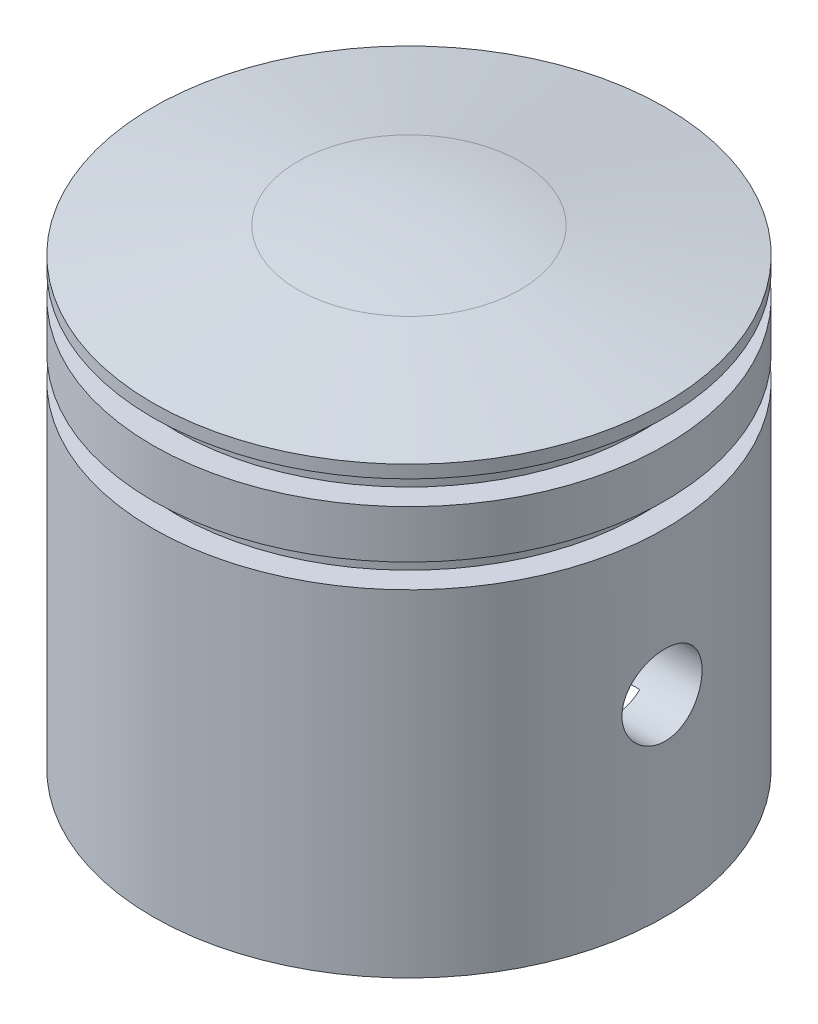
from build123d import *

# Parameters (mm, degrees)
SKETCH2_W               = 5.168520993
SKETCH2_H               = 1.5
SKETCH3_R               = 10
CUT_EXTRUDE1_DEPTH      = 24
SKETCH6_R               = 13
CUT_EXTRUDE2_DEPTH      = 10
CUT_EXTRUDE3_DEPTH      = 38.576588456
CUT_EXTRUDE3_DEPTH_BACK = 38.576588456
SKETCH7_R               = 2.5


with BuildPart() as part:
    # Sketch1 → Revolve2 (revolve)
    with BuildSketch(Plane.XY, mode=Mode.PRIVATE) as revolve2_sk:
        with BuildLine():
            Line((0, 0), (16, 0))
            Line((16, 0), (16, 27.795832784))
            Line((16, 27.795832784), (6.945927107, 29.39231012))
            ThreePointArc((6.945927107, 29.39231012), (3.48622971, 29.847787924), (0, 30))
            Line((0, 30), (0, 0))
        make_face()
    revolve(revolve2_sk.sketch.rotate(Axis((0, 30, 0), (0, -1, 0)), 90), axis=Axis((0, 30, 0), (0, -1, 0)))

    # Sketch2 → Cut-Revolve1 (revolve, cut)
    with BuildSketch(Plane(origin=(0, 0, 0), x_dir=(0, 0, -1), z_dir=(1, 0, 0)), mode=Mode.PRIVATE) as cut_revolve1_sk:
        with Locations((17.084260497, 26.25)):
            Rectangle(SKETCH2_W, SKETCH2_H)
        with Locations((17.084260497, 21.75)):
            Rectangle(SKETCH2_W, SKETCH2_H)
    revolve(cut_revolve1_sk.sketch.rotate(Axis((0, 0, 0), (0, 1, 0)), 180), axis=Axis((0, 0, 0), (0, 1, 0)), mode=Mode.SUBTRACT)

    # Sketch3 → Cut-Extrude1 (cut)
    with BuildSketch(Plane.XZ):
        with Locations(Location((0, 0, 0), (0, 0, 270))):
            Circle(SKETCH3_R)
    extrude(amount=-CUT_EXTRUDE1_DEPTH, mode=Mode.SUBTRACT)

    # Sketch6 → Cut-Extrude2 (cut)
    with BuildSketch(Plane.XZ):
        with Locations(Location((0, 0, 0), (0, 0, 270))):
            Circle(SKETCH6_R)
    extrude(amount=-CUT_EXTRUDE2_DEPTH, mode=Mode.SUBTRACT)

    # Sketch7 → Cut-Extrude3 (cut, two sides: drawn at the far end of the back side and taken through both)
    with BuildSketch(Plane(origin=(0, 0, 0), x_dir=(0, 0, -1), z_dir=(1, 0, 0)).offset(-CUT_EXTRUDE3_DEPTH_BACK)):
        with Locations(Location((0, 12, 0), (0, 0, 306.869897646))):
            Circle(SKETCH7_R)
    extrude(amount=CUT_EXTRUDE3_DEPTH + CUT_EXTRUDE3_DEPTH_BACK, mode=Mode.SUBTRACT)


solid = part.part
